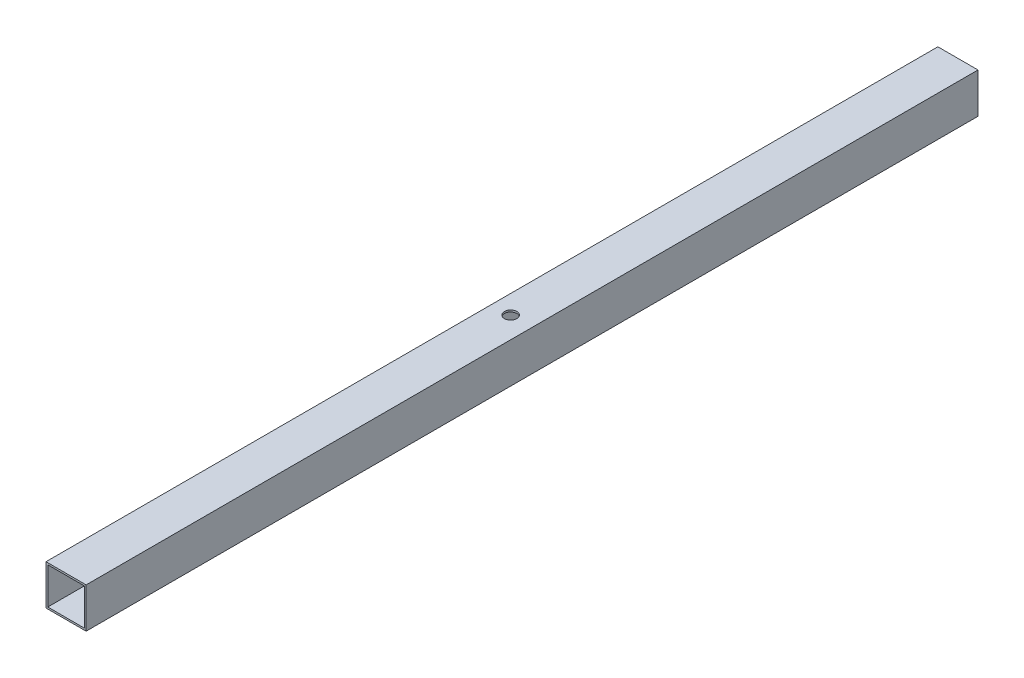
from build123d import *

# Parameters (mm, degrees)
CROQUIS2_W              = 45
CROQUIS2_H              = 45
SALIENTE_EXTRUIR3_DEPTH = 1000
CROQUIS12_W             = 41
CROQUIS12_H             = 41
CORTAR_EXTRUIR8_DEPTH   = 1003.022953829
CROQUIS13_R             = 7
CORTAR_EXTRUIR9_DEPTH   = 1.6
CROQUIS15_R             = 7
CORTAR_EXTRUIR11_DEPTH  = 1003.022953829


with BuildPart() as part:
    # Croquis2 → Saliente-Extruir3 (new body)
    with BuildSketch(Plane.XY):
        with Locations((22.5, 22.5)):
            Rectangle(CROQUIS2_W, CROQUIS2_H)
    extrude(amount=SALIENTE_EXTRUIR3_DEPTH)

    # Croquis12 → Cortar-Extruir8 (cut, through all)
    with BuildSketch(Plane(origin=(0, 0, 0), x_dir=(-1, 0, 0), z_dir=(0, 0, -1))):
        with Locations((-22.5, 22.5)):
            Rectangle(CROQUIS12_W, CROQUIS12_H)
    extrude(amount=-CORTAR_EXTRUIR8_DEPTH, mode=Mode.SUBTRACT)

    # Croquis13 → Cortar-Extruir9 (cut)
    with BuildSketch(Plane.XZ):
        with Locations((22.5, 980)):
            Circle(CROQUIS13_R)
        with Locations((22.5, 940)):
            Circle(CROQUIS13_R)
        with Locations((22.5, 20)):
            Circle(CROQUIS13_R)
        with Locations((22.5, 60)):
            Circle(CROQUIS13_R)
    extrude(amount=-CORTAR_EXTRUIR9_DEPTH, mode=Mode.SUBTRACT)

    # Croquis15 → Cortar-Extruir11 (cut, through all)
    with BuildSketch(Plane.XZ):
        with Locations((21, 500)):
            Circle(CROQUIS15_R)
    extrude(amount=-CORTAR_EXTRUIR11_DEPTH, mode=Mode.SUBTRACT)


solid = part.part
